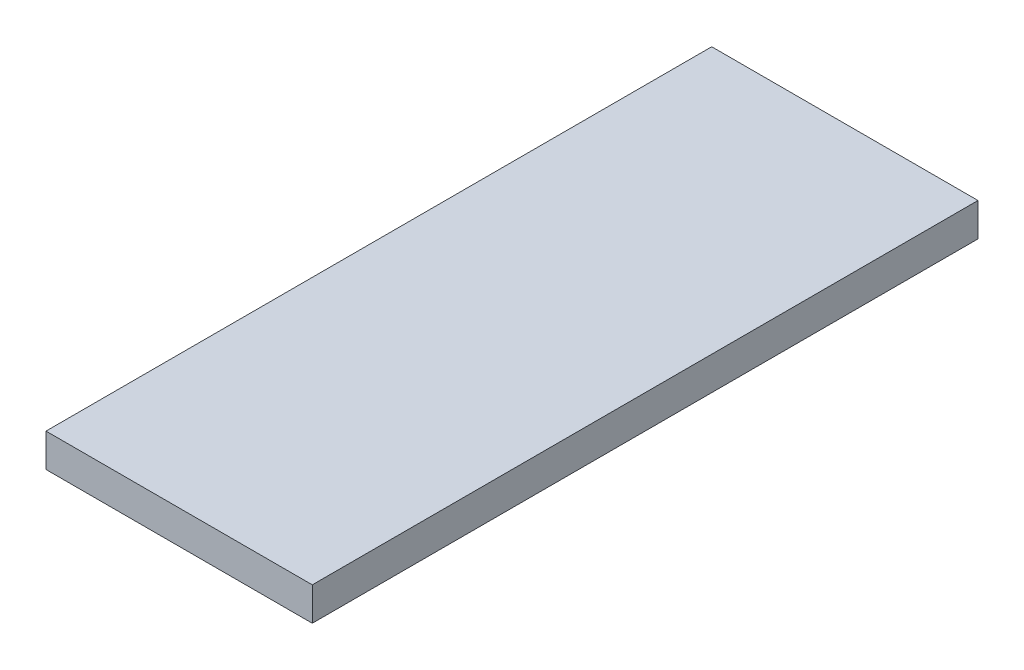
from build123d import *

# Parameters (mm, degrees)
SKETCH1_W           = 8
SKETCH1_H           = 20
BOSS_EXTRUDE1_DEPTH = 1


with BuildPart() as part:
    # Sketch1 → Boss-Extrude1 (new body)
    with BuildSketch(Plane(origin=(0, 0, 0), x_dir=(1, 0, 0), z_dir=(0, 1, 0))):
        Rectangle(SKETCH1_W, SKETCH1_H)
    extrude(amount=BOSS_EXTRUDE1_DEPTH)


solid = part.part
